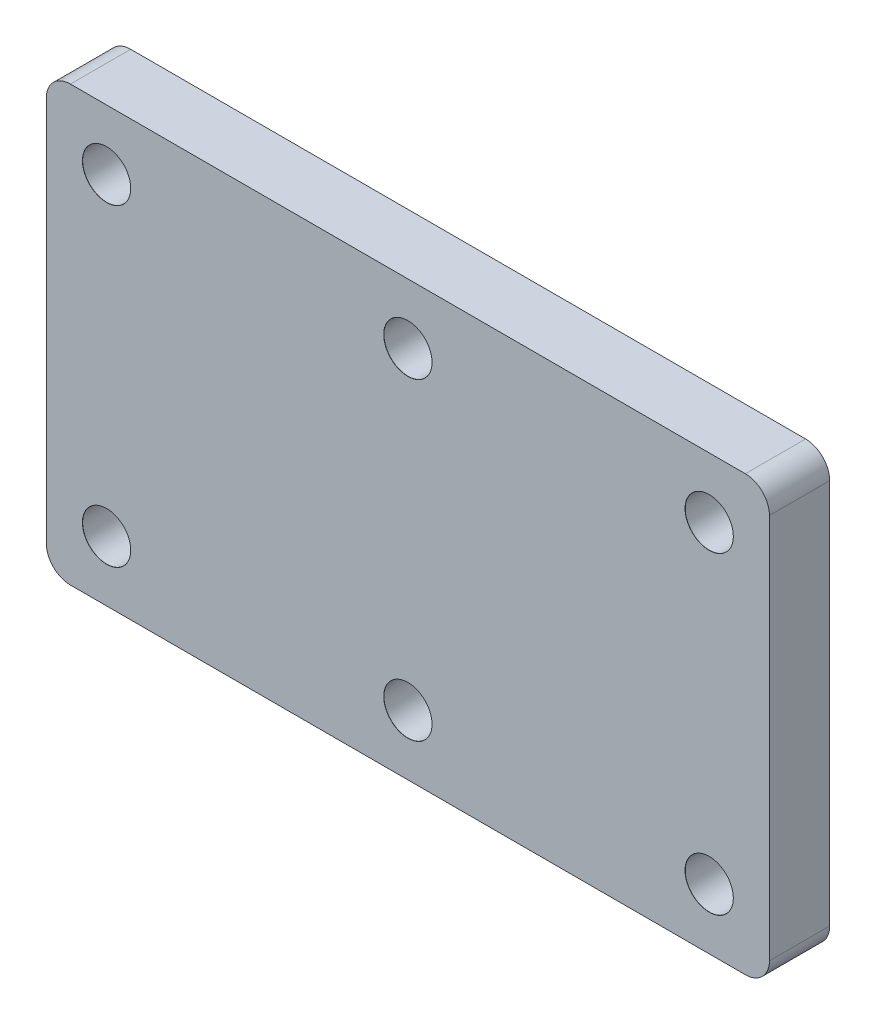
from build123d import *

# Parameters (mm, degrees)
SKETCH3_W                        = 300
SKETCH3_H                        = 180
SKETCH3_R                        = 10
BOSS_EXTRUDE2_DEPTH              = 25
FILLET1_R                        = 10
FILLET2_R                        = 10
F_20_0MM_DOWEL_HOLE4_D           = 20
F_20_0MM_DOWEL_HOLE4_DEPTH       = 27.005
F_20_0MM_DOWEL_HOLE4_CSINK_D     = 20.05
F_20_0MM_DOWEL_HOLE4_CSINK_ANGLE = 45
F_20_0MM_DOWEL_HOLE4_TIP         = 6.00860619


with BuildPart() as part:
    # Sketch3 → Boss-Extrude2 (new body)
    with BuildSketch(Plane.XY):
        Rectangle(SKETCH3_W, SKETCH3_H)
        with Locations((-125, 65)):
            Circle(SKETCH3_R, mode=Mode.SUBTRACT)
        with Locations((-125, -65)):
            Circle(SKETCH3_R, mode=Mode.SUBTRACT)
        with Locations((0, 65)):
            Circle(SKETCH3_R, mode=Mode.SUBTRACT)
        with Locations((0, -65)):
            Circle(SKETCH3_R, mode=Mode.SUBTRACT)
        with Locations((125, 65)):
            Circle(SKETCH3_R, mode=Mode.SUBTRACT)
        with Locations((125, -65)):
            Circle(SKETCH3_R, mode=Mode.SUBTRACT)
    extrude(amount=BOSS_EXTRUDE2_DEPTH)

    # Fillet1
    fillet1_edges = [part.edges().sort_by_distance(p)[0] for p in [
        (-150, 90, 12.5),
    ]]
    fillet(fillet1_edges, radius=FILLET1_R)

    # Fillet2
    fillet2_edges = [part.edges().sort_by_distance(p)[0] for p in [
        (150, 90, 12.5),
        (150, -90, 12.5),
        (-150, -90, 12.5),
    ]]
    fillet(fillet2_edges, radius=FILLET2_R)

    # Sketch7 → Ø20.0mm Dowel Hole3 (revolve, cut)
    with BuildSketch(Plane(origin=(-125, 65, 25), x_dir=(0, -1, 0), z_dir=(1, 0, 0))):
        Polygon((0, 0), (0, 33.01360619), (10, 27.005), (10, 0.060355339), (10.025, 0), align=None)
    f_20_0mm_dowel_hole3 = revolve(axis=Axis((-125, 65, 31.35), (0, 0, -1)), mode=Mode.SUBTRACT)

    # Mirror2: Ø20.0mm Dowel Hole3 across plane
    add(f_20_0mm_dowel_hole3.mirror(Plane.XY.offset(25)), mode=Mode.SUBTRACT)

    # Ø20.0mm Dowel Hole4
    with Locations(Plane(origin=(-125, 65, 25), x_dir=(1, 0, 0), z_dir=(0, 0, 1))):
        with Locations((0, 0), (0, -130), (125, 0), (125, -130), (250, -130), (250, 0)):
            CounterSinkHole(F_20_0MM_DOWEL_HOLE4_D / 2, F_20_0MM_DOWEL_HOLE4_CSINK_D / 2, depth=F_20_0MM_DOWEL_HOLE4_DEPTH, counter_sink_angle=F_20_0MM_DOWEL_HOLE4_CSINK_ANGLE)
            with Locations((0, 0, -(F_20_0MM_DOWEL_HOLE4_DEPTH + F_20_0MM_DOWEL_HOLE4_TIP / 2))):  # 118° drill point
                Cone(0, F_20_0MM_DOWEL_HOLE4_D / 2, F_20_0MM_DOWEL_HOLE4_TIP, mode=Mode.SUBTRACT)


solid = part.part
